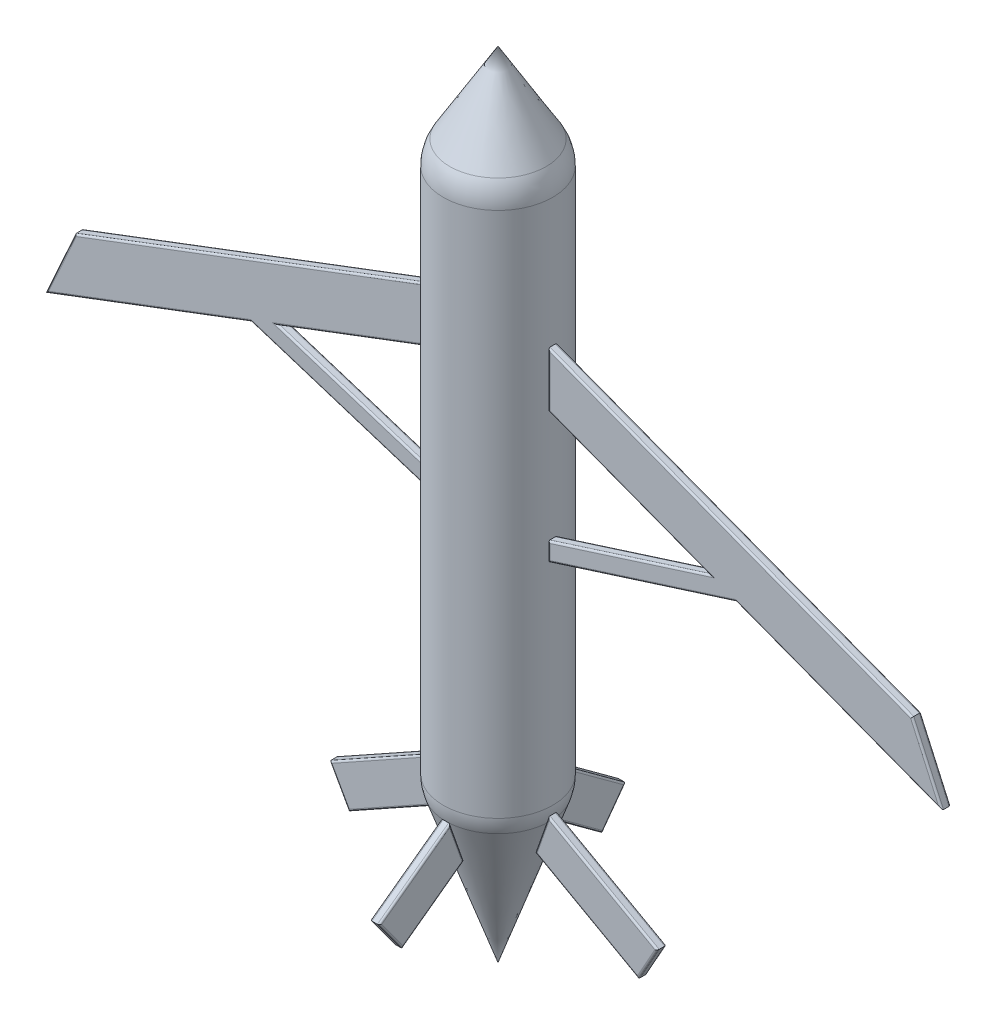
from build123d import *

# Parameters (mm, degrees)
EXTRUDE_1_DEPTH        = 5
EXTRUDE_1_DEPTH_BACK   = 5
EXTRUDE_1_2_DEPTH      = 5
EXTRUDE_1_2_DEPTH_BACK = 5
EXTRUDE_2_DEPTH        = 5
EXTRUDE_2_DEPTH_BACK   = 5
EXTRUDE_2_2_DEPTH      = 5
EXTRUDE_2_2_DEPTH_BACK = 5
FILLET_1_R             = 2
FILLET_2_R             = 2
FILLET_3_R             = 2
FILLET_4_R             = 2
FILLET_5_R             = 50
FILLET_6_R             = 50
EXTRUDE_3_DEPTH        = 5
EXTRUDE_3_DEPTH_BACK   = 5
EXTRUDE_3_2_DEPTH      = 5
EXTRUDE_3_2_DEPTH_BACK = 5
FILLET_7_R             = 2
FILLET_8_R             = 2


with BuildPart() as part:
    # 草图2 → 旋转1 (revolve)
    with BuildSketch(Plane.XY):
        Polygon((0, 0), (0, 500), (60, 400), (60, -200), (0, -200), align=None)
    revolve(axis=Axis((0, 0, 0), (0, 1, 0)))

    # 草图5 → 旋转2 (revolve)
    with BuildSketch(Plane.XY):
        Polygon((0, -200), (0, -370.771320176), (-60, -200), align=None)
    revolve(axis=Axis((0, -200, 0), (0, -1, 0)))

    # 圆角5
    fillet_5_edges = [part.edges().sort_by_distance(p)[0] for p in [
        (-60, 400, 0),
    ]]
    fillet(fillet_5_edges, radius=FILLET_5_R)

    # 圆角6
    fillet_6_edges = [part.edges().sort_by_distance(p)[0] for p in [
        (0, -200, -60),
    ]]
    fillet(fillet_6_edges, radius=FILLET_6_R)


with BuildPart() as body_2:
    # 草图3 → 凸台-拉伸1 (new, two sides: drawn at the far end of the back side and taken through both)
    with BuildSketch(Plane.XY.offset(-EXTRUDE_1_DEPTH_BACK)):
        Polygon((-60, 245.415694678), (-459.20797539, 94.15469375), (-491.764180738, 21.876413004), (-265.951571519, 107.437432317), (-60, 41.819663893), (-60, 62.243090179), (-236.671114858, 118.531877958), (-60, 185.473049767), align=None)
    extrude(amount=EXTRUDE_1_DEPTH + EXTRUDE_1_DEPTH_BACK)

    # 圆角1
    fillet_1_edges = [body_2.edges().sort_by_distance(p)[0] for p in [
        (-148.335557429, 152.002463863, 5),
        (-148.335557429, 90.387484068, 5),
        (-60, 52.031377036, 5),
        (-162.97578576, 74.628548105, 5),
        (-378.857876129, 64.65692266, 5),
        (-475.486078064, 58.015553377, 5),
        (-259.603987695, 169.785194214, 5),
        (-60, 215.444372223, 5),
        (-259.603987695, 169.785194214, -5),
        (-475.486078064, 58.015553377, -5),
        (-378.857876129, 64.65692266, -5),
        (-162.97578576, 74.628548105, -5),
        (-60, 52.031377036, -5),
        (-148.335557429, 90.387484068, -5),
        (-148.335557429, 152.002463863, -5),
        (-60, 215.444372223, -5),
    ]]
    fillet(fillet_1_edges, radius=FILLET_1_R)


with BuildPart() as body_3:
    # 草图3 → Extrude 1 2 (new, two sides: drawn at the far end of the back side and taken through both)
    with BuildSketch(Plane.XY.offset(-EXTRUDE_1_2_DEPTH_BACK)):
        Polygon((265.951571519, 107.437432317), (60, 41.819663893), (60, 62.243090179), (236.671114858, 118.531877958), (60, 185.473049767), (60, 245.415694678), (459.20797539, 94.15469375), (491.764180738, 21.876413004), align=None)
    extrude(amount=EXTRUDE_1_2_DEPTH + EXTRUDE_1_2_DEPTH_BACK)

    # 圆角2
    fillet_2_edges = [body_3.edges().sort_by_distance(p)[0] for p in [
        (475.486078064, 58.015553377, -5),
        (259.603987695, 169.785194214, -5),
        (60, 215.444372223, -5),
        (148.335557429, 152.002463863, -5),
        (148.335557429, 90.387484068, -5),
        (60, 52.031377036, -5),
        (162.97578576, 74.628548105, -5),
        (378.857876129, 64.65692266, -5),
        (162.97578576, 74.628548105, 5),
        (60, 52.031377036, 5),
        (148.335557429, 90.387484068, 5),
        (148.335557429, 152.002463863, 5),
        (60, 215.444372223, 5),
        (259.603987695, 169.785194214, 5),
        (475.486078064, 58.015553377, 5),
        (378.857876129, 64.65692266, 5),
    ]]
    fillet(fillet_2_edges, radius=FILLET_2_R)


with BuildPart() as body_4:
    # 草图6 → 凸台-拉伸2 (new, two sides: drawn at the far end of the back side and taken through both)
    with BuildSketch(Plane.XY.offset(-EXTRUDE_2_DEPTH_BACK)):
        Polygon((-60, -200), (-179.826175062, -266.853333767), (-158.860871533, -304.430998026), (-45.524956299, -241.198705374), align=None)
    extrude(amount=EXTRUDE_2_DEPTH + EXTRUDE_2_DEPTH_BACK)

    # 圆角4
    fillet_4_edges = [body_4.edges().sort_by_distance(p)[0] for p in [
        (-119.913087531, -233.426666884, -5),
        (-169.343523297, -285.642165897, -5),
        (-102.192913916, -272.8148517, -5),
        (-52.76247815, -220.599352687, -5),
        (-102.192913916, -272.8148517, 5),
        (-169.343523297, -285.642165897, 5),
        (-119.913087531, -233.426666884, 5),
        (-52.76247815, -220.599352687, 5),
    ]]
    fillet(fillet_4_edges, radius=FILLET_4_R)


with BuildPart() as body_5:
    # 草图6 → Extrude 2 2 (new, two sides: drawn at the far end of the back side and taken through both)
    with BuildSketch(Plane.XY.offset(-EXTRUDE_2_2_DEPTH_BACK)):
        Polygon((158.860871533, -304.430998026), (45.524956299, -241.198705374), (60, -200), (179.826175062, -266.853333767), align=None)
    extrude(amount=EXTRUDE_2_2_DEPTH + EXTRUDE_2_2_DEPTH_BACK)

    # 圆角3
    fillet_3_edges = [body_5.edges().sort_by_distance(p)[0] for p in [
        (102.192913916, -272.8148517, 5),
        (52.76247815, -220.599352687, 5),
        (119.913087531, -233.426666884, 5),
        (169.343523297, -285.642165897, 5),
        (119.913087531, -233.426666884, -5),
        (52.76247815, -220.599352687, -5),
        (102.192913916, -272.8148517, -5),
        (169.343523297, -285.642165897, -5),
    ]]
    fillet(fillet_3_edges, radius=FILLET_3_R)


with BuildPart() as body_6:
    # 草图7 → 凸台-拉伸3 (new, two sides: drawn at the far end of the back side and taken through both)
    with BuildSketch(Plane(origin=(0, 0, 0), x_dir=(0, 0, -1), z_dir=(1, 0, 0)).offset(-EXTRUDE_3_DEPTH_BACK)):
        Polygon((-57.173070403, -208.045974988), (-135.365840389, -265.265464672), (-109.756025707, -300.262322558), (-42.154059128, -250.792914709), align=None)
    extrude(amount=EXTRUDE_3_DEPTH + EXTRUDE_3_DEPTH_BACK)

    # 圆角7
    fillet_7_edges = [body_6.edges().sort_by_distance(p)[0] for p in [
        (5, -275.527618634, 75.955042417),
        (5, -282.763893615, 122.560933048),
        (5, -236.65571983, 96.269455396),
        (5, -229.419444849, 49.663564765),
        (-5, -236.65571983, 96.269455396),
        (-5, -282.763893615, 122.560933048),
        (-5, -275.527618634, 75.955042417),
        (-5, -229.419444849, 49.663564765),
    ]]
    fillet(fillet_7_edges, radius=FILLET_7_R)


with BuildPart() as body_7:
    # 草图7 → Extrude 3 2 (new, two sides: drawn at the far end of the back side and taken through both)
    with BuildSketch(Plane(origin=(0, 0, 0), x_dir=(0, 0, -1), z_dir=(1, 0, 0)).offset(-EXTRUDE_3_2_DEPTH_BACK)):
        Polygon((109.756025707, -300.262322558), (42.154059128, -250.792914709), (57.173070403, -208.045974988), (135.365840389, -265.265464672), align=None)
    extrude(amount=EXTRUDE_3_2_DEPTH + EXTRUDE_3_2_DEPTH_BACK)

    # 圆角8
    fillet_8_edges = [body_7.edges().sort_by_distance(p)[0] for p in [
        (-5, -236.65571983, -96.269455396),
        (-5, -229.419444849, -49.663564765),
        (-5, -275.527618634, -75.955042417),
        (-5, -282.763893615, -122.560933048),
        (5, -275.527618634, -75.955042417),
        (5, -229.419444849, -49.663564765),
        (5, -236.65571983, -96.269455396),
        (5, -282.763893615, -122.560933048),
    ]]
    fillet(fillet_8_edges, radius=FILLET_8_R)


solid = Compound([part.part, body_2.part, body_3.part, body_4.part, body_5.part, body_6.part, body_7.part])
